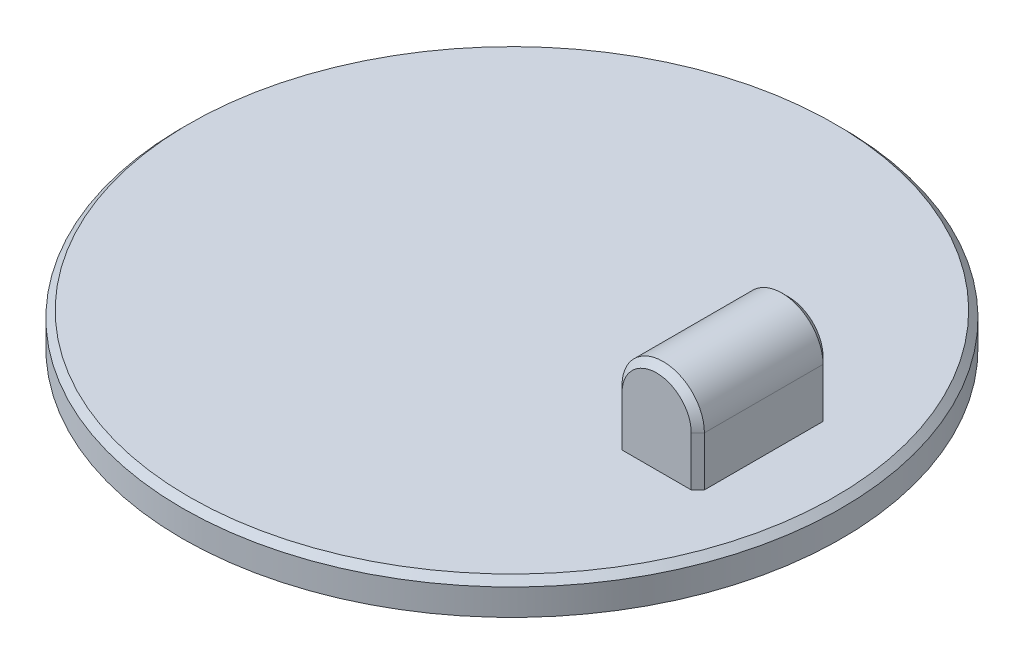
from build123d import *

# Parameters (mm, degrees)
SKETCH_1_R      = 100
EXTRUDE_1_DEPTH = 10
EXTRUDE_2_DEPTH = 20
CHAMFER_1_SIZE  = 2
CHAMFER_2_SIZE  = 2


with BuildPart() as part:
    # 草图1 → 凸台-拉伸1 (new body)
    with BuildSketch(Plane(origin=(0, 0, 0), x_dir=(1, 0, 0), z_dir=(0, 1, 0))):
        with Locations(Location((0, 0, 0), (0, 0, 270))):
            Circle(SKETCH_1_R)
    extrude(amount=EXTRUDE_1_DEPTH)

    # 草图2 → 凸台-拉伸2 (add, symmetric)
    with BuildSketch(Plane.XY):
        with BuildLine():
            Line((51.398957954, 25), (51.398957954, 10))
            Line((51.398957954, 10), (76.398957954, 10))
            Line((76.398957954, 10), (76.398957954, 25))
            ThreePointArc((76.398957954, 25), (63.898957954, 37.5), (51.398957954, 25))
        make_face()
    extrude(amount=EXTRUDE_2_DEPTH, both=True)

    # 倒角1
    chamfer_1_edges = [part.edges().sort_by_distance(p)[0] for p in [
        (51.398957954, 17.5, 20),
        (76.398957954, 17.5, 20),
        (63.898957954, 37.5, -20),
        (51.398957954, 17.5, -20),
        (76.398957954, 17.5, -20),
        (63.898957954, 37.5, 20),
    ]]
    chamfer(chamfer_1_edges, length=CHAMFER_1_SIZE)

    # 倒角2
    chamfer_2_edges = [part.edges().sort_by_distance(p)[0] for p in [
        (0, 10, -100),
    ]]
    chamfer(chamfer_2_edges, length=CHAMFER_2_SIZE)


solid = part.part
